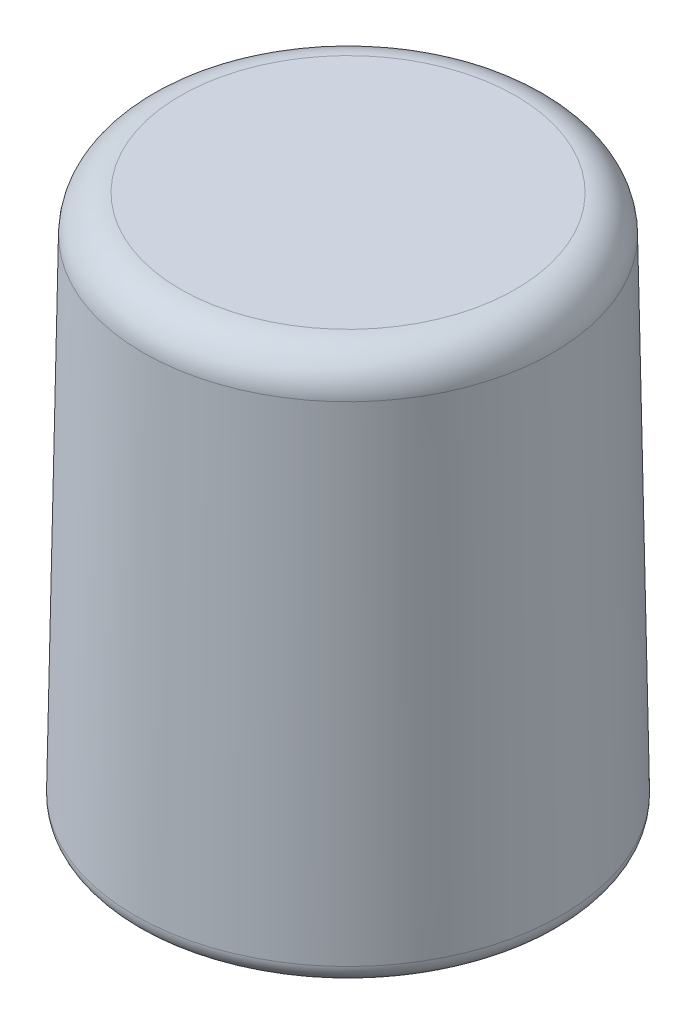
from build123d import *

# Parameters (mm, degrees)
SKETCH1_R           = 5.75
BOSS_EXTRUDE1_DEPTH = 14.5
BOSS_EXTRUDE1_TAPER = 1
FILLET1_R           = 1
FILLET2_R           = 0.5
CUT_EXTRUDE1_DEPTH  = 7


with BuildPart() as part:
    # Sketch1 → Boss-Extrude1 (new body)
    with BuildSketch(Plane(origin=(0, 0, 0), x_dir=(1, 0, 0), z_dir=(0, 1, 0))):
        Circle(SKETCH1_R)
    extrude(amount=BOSS_EXTRUDE1_DEPTH, taper=BOSS_EXTRUDE1_TAPER)

    # Fillet1
    fillet1_edges = [part.edges().sort_by_distance(p)[0] for p in [
        (-5.496901559, 14.5, 0),
    ]]
    fillet(fillet1_edges, radius=FILLET1_R)

    # Fillet2
    fillet2_edges = [part.edges().sort_by_distance(p)[0] for p in [
        (-5.75, 0, 0),
    ]]
    fillet(fillet2_edges, radius=FILLET2_R)

    # Sketch2 → Cut-Extrude1 (cut)
    with BuildSketch(Plane.XZ):
        with BuildLine():
            Line((2.598076211, -1.5), (-2.598076211, -1.5))
            ThreePointArc((-2.598076211, -1.5), (0, 3), (2.598076211, -1.5))
        make_face()
    extrude(amount=-CUT_EXTRUDE1_DEPTH, mode=Mode.SUBTRACT)


solid = part.part
